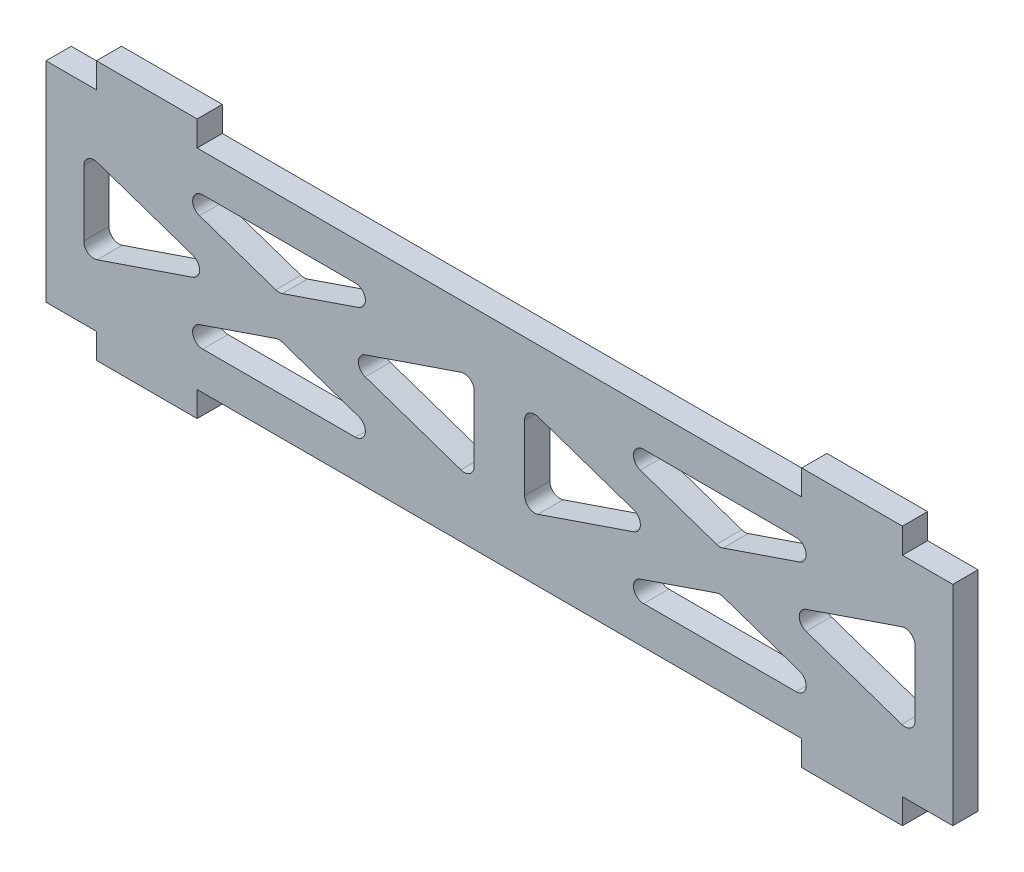
from build123d import *

# Parameters (mm, degrees)
BOSS_EXTRUDE1_DEPTH = 6.35
CUT_EXTRUDE1_DEPTH  = 237.19387672
FILLET1_R           = 2.54


with BuildPart() as part:
    # Sketch1 → Boss-Extrude1 (new body)
    with BuildSketch(Plane.XY):
        Polygon((0, 0), (12.7, 0), (12.7, -6.35), (38.1, -6.35), (38.1, 0), (190.5, 0), (190.5, -6.35), (215.9, -6.35), (215.9, 0), (228.6, 0), (228.6, 52.72), (215.9, 52.72), (215.9, 59.07), (190.5, 59.07), (190.5, 52.72), (38.1, 52.72), (38.1, 59.07), (12.7, 59.07), (12.7, 52.72), (0, 52.72), align=None)
    extrude(amount=BOSS_EXTRUDE1_DEPTH)

    # Sketch2 → Cut-Extrude1 (cut, through all)
    with BuildSketch(Plane.XY.offset(6.35)):
        Polygon((44.023573871, 26.36), (9.525, 38.161544143), (9.525, 14.558455857), align=None)
        Polygon((93.236073871, 43.195), (24.238926129, 43.195), (58.7375, 31.393455857), align=None)
        Polygon((107.95, 38.161544143), (73.451426129, 26.36), (107.95, 14.558455857), align=None)
        Polygon((93.236073871, 9.525), (58.7375, 21.326544143), (24.238926129, 9.525), align=None)
        Polygon((155.148573871, 26.36), (120.65, 38.161544143), (120.65, 14.558455857), align=None)
        Polygon((204.361073871, 43.195), (135.363926129, 43.195), (169.8625, 31.393455857), align=None)
        Polygon((219.075, 38.161544143), (184.576426129, 26.36), (219.075, 14.558455857), align=None)
        Polygon((204.361073871, 9.525), (169.8625, 21.326544143), (135.363926129, 9.525), align=None)
    extrude(amount=-CUT_EXTRUDE1_DEPTH, mode=Mode.SUBTRACT)

    # Fillet1
    fillet1_edges = [part.edges().sort_by_distance(p)[0] for p in [
        (73.451426129, 26.36, 3.175),
        (107.95, 38.161544143, 3.175),
        (107.95, 14.558455857, 3.175),
        (204.361073871, 9.525, 3.175),
        (135.363926129, 9.525, 3.175),
        (169.8625, 21.326544143, 3.175),
        (169.8625, 31.393455857, 3.175),
        (135.363926129, 43.195, 3.175),
        (204.361073871, 43.195, 3.175),
        (219.075, 14.558455857, 3.175),
        (184.576426129, 26.36, 3.175),
        (219.075, 38.161544143, 3.175),
        (9.525, 14.558455857, 3.175),
        (9.525, 38.161544143, 3.175),
        (44.023573871, 26.36, 3.175),
        (155.148573871, 26.36, 3.175),
        (120.65, 14.558455857, 3.175),
        (120.65, 38.161544143, 3.175),
        (24.238926129, 9.525, 3.175),
        (58.7375, 21.326544143, 3.175),
        (93.236073871, 9.525, 3.175),
        (58.7375, 31.393455857, 3.175),
        (24.238926129, 43.195, 3.175),
        (93.236073871, 43.195, 3.175),
    ]]
    fillet(fillet1_edges, radius=FILLET1_R)


solid = part.part
